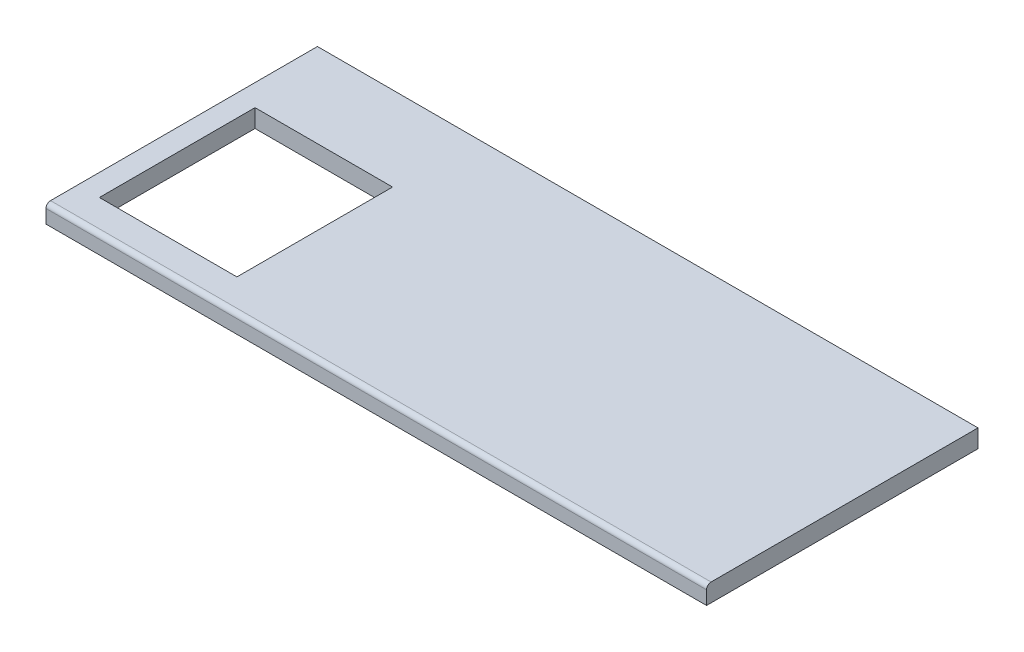
from build123d import *

# Parameters (mm, degrees)
SKETCH1_W           = 1460
SKETCH1_H           = 600
BOSS_EXTRUDE1_DEPTH = 40
FILLET1_R           = 10
CUT_EXTRUDE1_REACH  = 792.253
SKETCH2_W           = 304
SKETCH2_H           = 344


with BuildPart() as part:
    # Sketch1 → Boss-Extrude1 (new body)
    with BuildSketch(Plane(origin=(0, 0, 0), x_dir=(1, 0, 0), z_dir=(0, 1, 0))):
        Rectangle(SKETCH1_W, SKETCH1_H)
    extrude(amount=BOSS_EXTRUDE1_DEPTH)

    # Fillet1
    fillet1_edges = [part.edges().sort_by_distance(p)[0] for p in [
        (0, 40, 300),
    ]]
    fillet(fillet1_edges, radius=FILLET1_R)

    # Sketch2 → Cut-Extrude1 (cut, up to next)
    with BuildSketch(Plane(origin=(0, 40, 0), x_dir=(1, 0, 0), z_dir=(0, 1, 0)), mode=Mode.PRIVATE) as cut_extrude1_sk1:
        with Locations((-530, -58)):
            Rectangle(SKETCH2_W, SKETCH2_H)
    cut_extrude1_tool1 = extrude(cut_extrude1_sk1.sketch, amount=-CUT_EXTRUDE1_REACH, mode=Mode.PRIVATE) & part.part
    add(cut_extrude1_tool1.solids().sort_by_distance((-530, 40, 58))[0], mode=Mode.SUBTRACT)


solid = part.part
